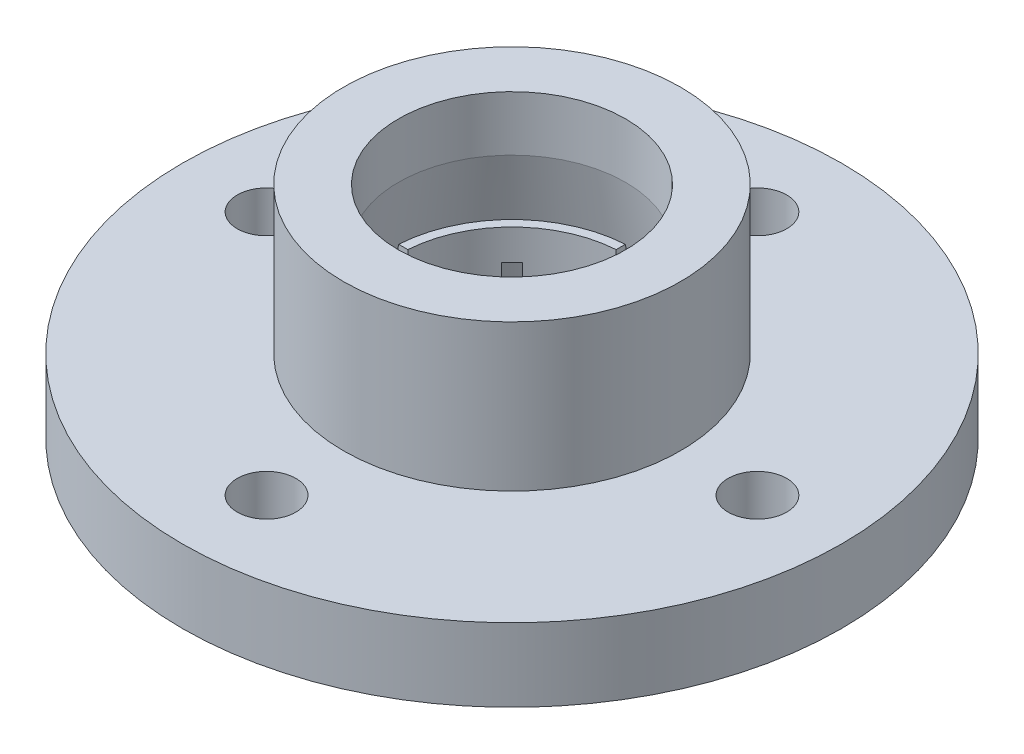
from build123d import *

# Parameters (mm, degrees)
M2X0_4_TAPPED_HOLE1_D   = 1.6
CIRPATTERN1_COUNT       = 4
SKETCH7_W               = 0.4
SKETCH7_H               = 6
CUT_EXTRUDE_THIN1_DEPTH = 2.5
CUT_EXTRUDE_THIN2_DEPTH = 2.5
CIRPATTERN2_COUNT       = 4


with BuildPart() as part:
    # Sketch2 → Revolve1 (revolve)
    with BuildSketch(Plane(origin=(0, 0, 0), x_dir=(0, 0, -1), z_dir=(1, 0, 0))):
        Polygon((-3.1, 6), (-3.1, 4.5), (-3.893471413, 0), (-9, 0), (-9, 2), (-4.6, 2), (-4.6, 6), align=None)
    revolve(axis=Axis((0, 8.4, 0), (0, -1, 0)))

    # M2x0.4 Tapped Hole1 (through all)
    with Locations(Plane(origin=(0, 2, 0), x_dir=(1, 0, 0), z_dir=(0, 1, 0))):
        with Locations((0, -6.7)):
            m2x0_4_tapped_hole1 = Hole(M2X0_4_TAPPED_HOLE1_D / 2)

    # CirPattern1: M2x0.4 Tapped Hole1 ×4 about axis
    cirpattern1_axis = Axis((0, 0, 0), (0, 1, 0))
    for i in range(1, CIRPATTERN1_COUNT):
        add(m2x0_4_tapped_hole1.rotate(cirpattern1_axis, i * 360 / CIRPATTERN1_COUNT), mode=Mode.SUBTRACT)


with BuildPart() as body_2:
    # Sketch6 → Revolve2 (revolve)
    with BuildSketch(Plane.XY, mode=Mode.PRIVATE) as revolve2_sk:
        Polygon((3.05, 2.83564091), (3.05, -0.5), (3.8, -0.5), (3.8, 0), (3.3, 2.83564091), align=None)
    revolve(revolve2_sk.sketch.rotate(Axis((0, 8.4, 0), (0, -1, 0)), 90), axis=Axis((0, 8.4, 0), (0, -1, 0)))

    # Sketch7 → Cut-Extrude-Thin1 (cut)
    with BuildSketch(Plane(origin=(0, 2.83564091, 0), x_dir=(1, 0, 0), z_dir=(0, 1, 0))):
        with Locations((0, 3)):
            Rectangle(SKETCH7_W, SKETCH7_H)
    cut_extrude_thin1 = extrude(amount=-CUT_EXTRUDE_THIN1_DEPTH, mode=Mode.SUBTRACT)

    # Sketch8 → Cut-Extrude-Thin2 (cut)
    with BuildSketch(Plane.XZ.offset(0.5)):
        Polygon((0.141421356, -0.141421356), (4.384062043, 4.101219331), (4.101219331, 4.384062043), (-0.141421356, 0.141421356), align=None)
    cut_extrude_thin2 = extrude(amount=-CUT_EXTRUDE_THIN2_DEPTH, mode=Mode.SUBTRACT)

    # CirPattern2: Cut-Extrude-Thin1, Cut-Extrude-Thin2 ×4 about axis
    cirpattern2_axis = Axis((0, 0, 0), (0, 1, 0))
    add([cut_extrude_thin1.rotate(cirpattern2_axis, i * 360 / CIRPATTERN2_COUNT) for i in range(1, CIRPATTERN2_COUNT)], mode=Mode.SUBTRACT)
    add([cut_extrude_thin2.rotate(cirpattern2_axis, i * 360 / CIRPATTERN2_COUNT) for i in range(1, CIRPATTERN2_COUNT)], mode=Mode.SUBTRACT)


solid = Compound([part.part, body_2.part])
